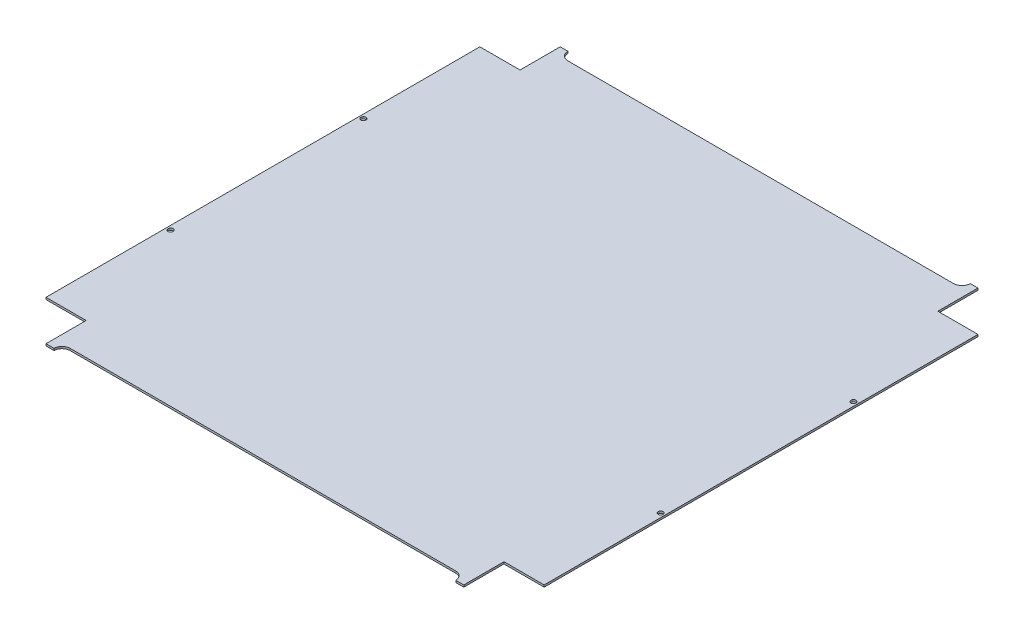
from build123d import *

# Parameters (mm, degrees)
BOSS_EXTRUDE1_DEPTH             = 1.5875
F_5_32_0_15625_DIAMETER_HOLE1_D = 3.96875


with BuildPart() as part:
    # Sketch1 → Boss-Extrude1 (new body)
    with BuildSketch(Plane(origin=(0, 0, 0), x_dir=(1, 0, 0), z_dir=(0, 1, 0))):
        with BuildLine():
            Line((-160.755952561, 205.005137025), (-166.848726493, 205.005137025))
            Line((-166.848726493, 205.005137025), (-166.848726493, 173.255137025))
            Line((-166.848726493, 173.255137025), (-198.598726493, 173.255137025))
            Line((-198.598726493, 173.255137025), (-198.598726493, -169.644862975))
            Line((-198.598726493, -169.644862975), (-166.848726493, -169.644862975))
            Line((-166.848726493, -169.644862975), (-166.848726493, -201.394862975))
            Line((-166.848726493, -201.394862975), (-160.498726493, -201.394862975))
            ThreePointArc((-160.498726493, -201.394862975), (-158.638854554, -196.904734914), (-154.148726493, -195.044862975))
            Line((-154.148726493, -195.044862975), (150.651273507, -195.044862975))
            ThreePointArc((150.651273507, -195.044862975), (155.141401567, -196.904734914), (157.001273507, -201.394862975))
            Line((157.001273507, -201.394862975), (163.351273507, -201.394862975))
            Line((163.351273507, -201.394862975), (163.351273507, -169.644862975))
            Line((163.351273507, -169.644862975), (195.101273507, -169.644862975))
            Line((195.101273507, -169.644862975), (195.101273507, 173.255137025))
            Line((195.101273507, 173.255137025), (163.351273507, 173.255137025))
            Line((163.351273507, 173.255137025), (163.351273507, 205.005137025))
            Line((163.351273507, 205.005137025), (157.258499575, 205.005137025))
            ThreePointArc((157.258499575, 205.005137025), (155.323287864, 200.333122668), (150.651273507, 198.397910957))
            Line((150.651273507, 198.397910957), (-154.148726493, 198.397910957))
            ThreePointArc((-154.148726493, 198.397910957), (-158.820740851, 200.333122668), (-160.755952561, 205.005137025))
        make_face()
    extrude(amount=BOSS_EXTRUDE1_DEPTH)

    # 5/32 (0.15625) Diameter Hole1 (through all)
    with Locations(Plane(origin=(0, 1.5875, 0), x_dir=(1, 0, 0), z_dir=(0, 1, 0))):
        with Locations((-195.423726493, 78.005137025), (-195.423726493, -74.394862975), (191.926273507, -74.394862975), (191.926273507, 78.005137025)):
            Hole(F_5_32_0_15625_DIAMETER_HOLE1_D / 2)


solid = part.part
